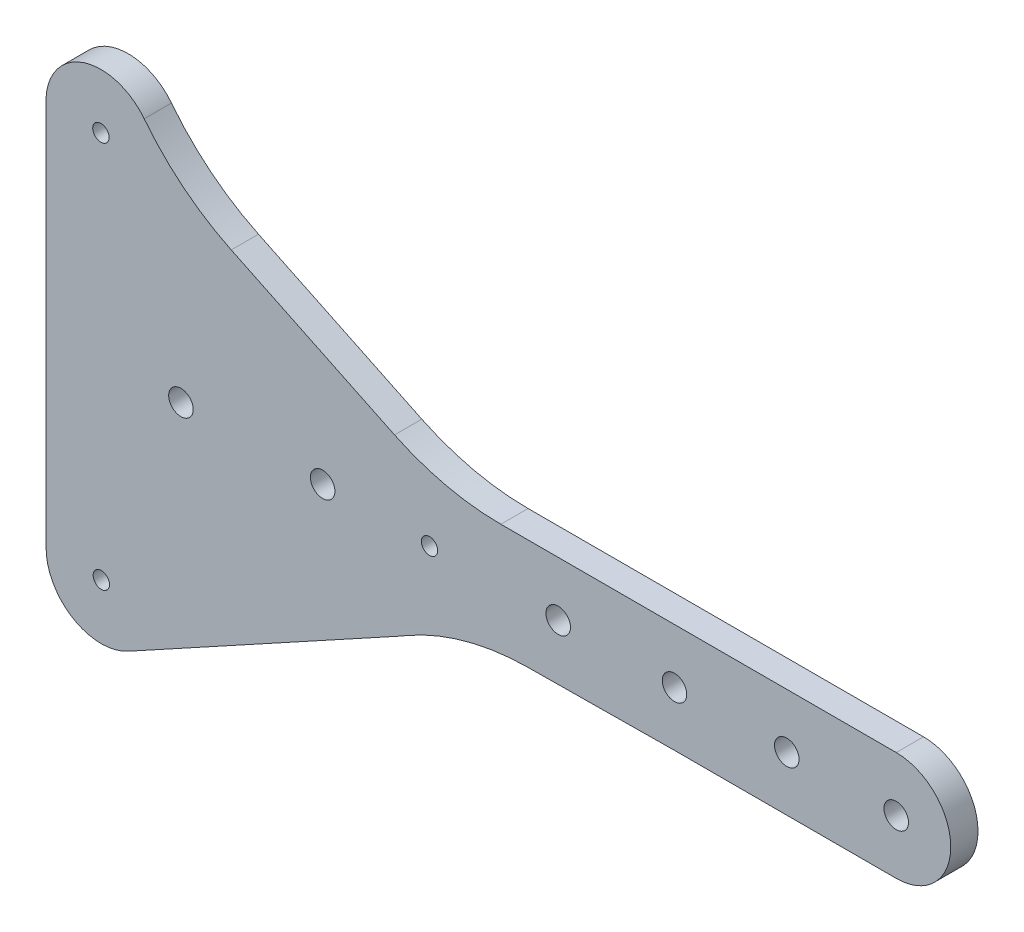
from build123d import *

# Parameters (mm, degrees)
CROQUIS1_R              = 2.25
CROQUIS1_R_2            = 2.55
CROQUIS1_R_3            = 1.5
SALIENTE_EXTRUIR1_DEPTH = 5
SALIENTE_EXTRUIR2_START = -5
CROQUIS2_R              = 2.55
CROQUIS2_R_2            = 1.5
SALIENTE_EXTRUIR2_DEPTH = 5


with BuildPart() as part:
    # Croquis1 → Saliente-Extruir1 (new body)
    with BuildSketch(Plane(origin=(0, 0, 0), x_dir=(-1, 0, 0), z_dir=(0, 0, -1))):
        with BuildLine():
            Line((-71.341040378, -16.363356968), (-70.419428585, -16.899757727))
            Line((-70.419428585, -16.899757727), (-20.270039886, -44.385636378))
            ThreePointArc((-20.270039886, -44.385636378), (-10.236419944, -44.21832916), (-5.267289487, -35.5))
            Line((-5.267289487, -35.5), (-5.267289487, 34.708239567))
            ThreePointArc((-5.267289487, 34.708239567), (-11.664110706, 44.896341112), (-23.263165727, 41.705940291))
            ThreePointArc((-23.263165727, 41.705940291), (-30.502802881, 34.357904526), (-39.225518904, 28.851526324))
            Line((-39.225518904, 28.851526324), (-69.184263586, 14.445246544))
            ThreePointArc((-69.184263586, 14.445246544), (-78.684950229, 11.125383731), (-88.685852551, 10))
            Line((-88.685852551, 10), (-120.543509993, 10))
            Line((-120.543509993, 10), (-161.221070033, 10))
            ThreePointArc((-161.221070033, 10), (-171.221070033, 0), (-161.221070033, -10))
            Line((-161.221070033, -10), (-120.543509993, -10))
            Line((-120.543509993, -10), (-93.547882821, -10.2575901))
            ThreePointArc((-93.547882821, -10.2575901), (-82.047232991, -11.865742134), (-71.341040378, -16.363356968))
        make_face()
        with Locations(Location((-30, 0, 0), (0, 0, 180))):
            Circle(CROQUIS1_R, mode=Mode.SUBTRACT)
        with Locations(Location((-15.4, -35.5, 0), (0, 0, 180))):
            Circle(CROQUIS1_R_2, mode=Mode.SUBTRACT)
        with Locations(Location((-15.317880165, 35.5, 0), (0, 0, 180))):
            Circle(CROQUIS1_R_2, mode=Mode.SUBTRACT)
        with Locations(Location((-141.14380115, 0, 0), (0, 0, 180))):
            Circle(CROQUIS1_R, mode=Mode.SUBTRACT)
        with Locations(Location((-161.221070033, 0, 0), (0, 0, 180))):
            Circle(CROQUIS1_R, mode=Mode.SUBTRACT)
        with Locations(Location((-56, 0, 0), (0, 0, 180))):
            Circle(CROQUIS1_R, mode=Mode.SUBTRACT)
        with Locations(Location((-75.6, 0, 0), (0, 0, 180))):
            Circle(CROQUIS1_R_3, mode=Mode.SUBTRACT)
        with Locations(Location((-99.210066217, 0, 0), (0, 0, 180))):
            Circle(CROQUIS1_R, mode=Mode.SUBTRACT)
        with Locations(Location((-120.543509993, 0, 0), (0, 0, 180))):
            Circle(CROQUIS1_R, mode=Mode.SUBTRACT)
    extrude(amount=-SALIENTE_EXTRUIR1_DEPTH)

    # Croquis2 → Saliente-Extruir2 (add)
    # profile 1 of 2: a face of its own
    with BuildSketch(Plane.XY.offset(5).offset(SALIENTE_EXTRUIR2_START)):
        with Locations((15.4, -35.5)):
            Circle(CROQUIS2_R)
        with Locations((15.4, -35.5)):
            Circle(CROQUIS2_R_2, mode=Mode.SUBTRACT)
    # profile 2 of 2: a face of its own
    with BuildSketch(Plane.XY.offset(5).offset(SALIENTE_EXTRUIR2_START)):
        with Locations((15.317880165, 35.5)):
            Circle(CROQUIS2_R)
        with Locations((15.317880165, 35.5)):
            Circle(CROQUIS2_R_2, mode=Mode.SUBTRACT)
    extrude(amount=SALIENTE_EXTRUIR2_DEPTH)


solid = part.part
